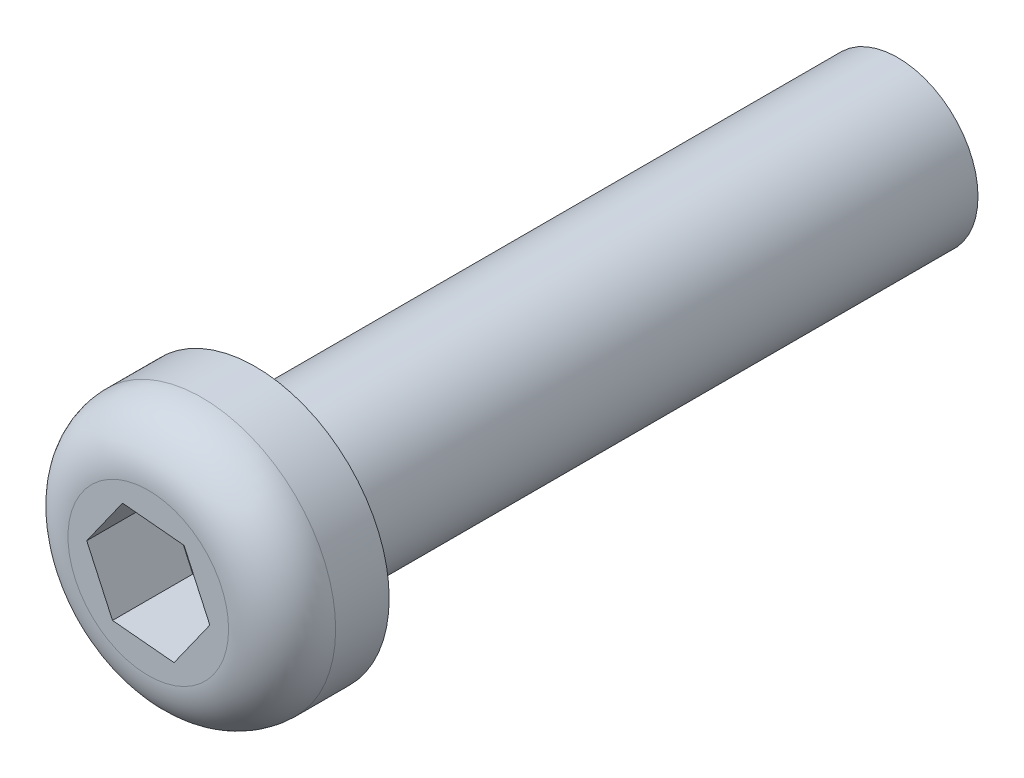
from build123d import *

# Parameters (mm, degrees)
SKETCH_1_R          = 1.5
EXTRUDE_1_DEPTH     = 12
SKETCH_2_R          = 2.5
EXTRUDE_2_DEPTH     = 2
CUT_EXTRUDE_1_DEPTH = 1.5
FILLET_2_R          = 1


with BuildPart() as part:
    # 草图1 → 凸台-拉伸1 (new body)
    with BuildSketch(Plane.XY):
        Circle(SKETCH_1_R)
    extrude(amount=EXTRUDE_1_DEPTH)

    # 草图2 → 凸台-拉伸2 (add)
    with BuildSketch(Plane.XY.offset(12)):
        Circle(SKETCH_2_R)
    extrude(amount=EXTRUDE_2_DEPTH)

    # 草图3 → 切除-拉伸1 (cut)
    with BuildSketch(Plane.XY.offset(14)):
        Polygon((1.149641735, -0.107968584), (0.668324404, 0.941634655), (-0.481317331, 1.04960324), (-1.149641735, 0.107968584), (-0.668324404, -0.941634655), (0.481317331, -1.04960324), align=None)
    extrude(amount=-CUT_EXTRUDE_1_DEPTH, mode=Mode.SUBTRACT)

    # 圆角2
    fillet_2_edges = [part.edges().sort_by_distance(p)[0] for p in [
        (-2.5, 0, 14),
    ]]
    fillet(fillet_2_edges, radius=FILLET_2_R)


solid = part.part
